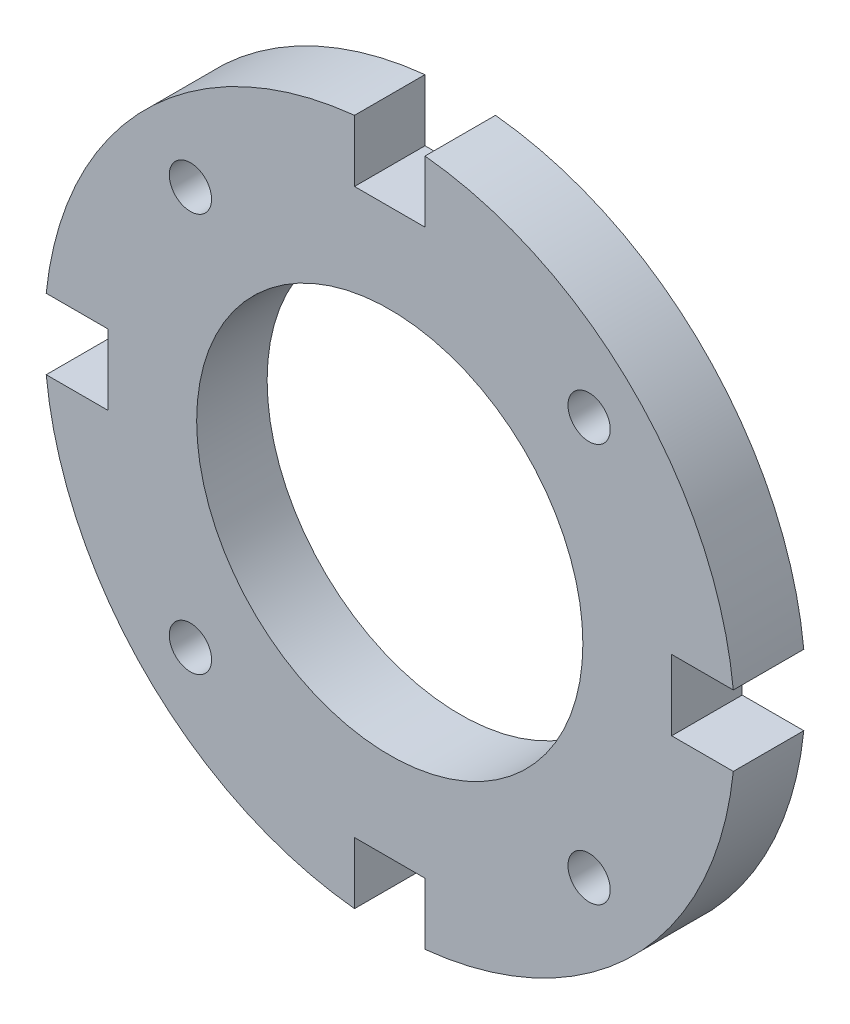
from build123d import *

# Parameters (mm, degrees)
ESQUISSE1_R        = 13.7
ESQUISSE1_R_2      = 1.5
BOSS_EXTRU_1_DEPTH = 5


with BuildPart() as part:
    # Esquisse1 → Boss.-Extru.1 (new body)
    with BuildSketch(Plane.XY):
        with BuildLine():
            Line((24.372115214, 2.5), (20, 2.5))
            Line((20, 2.5), (20, -2.5))
            Line((20, -2.5), (24.372115214, -2.5))
            ThreePointArc((24.372115214, -2.5), (17.324116139, -17.324116139), (2.5, -24.372115214))
            Line((2.5, -24.372115214), (2.5, -20))
            Line((2.5, -20), (-2.5, -20))
            Line((-2.5, -20), (-2.5, -24.372115214))
            ThreePointArc((-2.5, -24.372115214), (-17.324116139, -17.324116139), (-24.372115214, -2.5))
            Line((-24.372115214, -2.5), (-20, -2.5))
            Line((-20, -2.5), (-20, 2.5))
            Line((-20, 2.5), (-24.372115214, 2.5))
            ThreePointArc((-24.372115214, 2.5), (-17.324116139, 17.324116139), (-2.5, 24.372115214))
            Line((-2.5, 24.372115214), (-2.5, 20))
            Line((-2.5, 20), (2.5, 20))
            Line((2.5, 20), (2.5, 24.372115214))
            ThreePointArc((2.5, 24.372115214), (17.324116139, 17.324116139), (24.372115214, 2.5))
        make_face()
        Circle(ESQUISSE1_R, mode=Mode.SUBTRACT)
        with Locations((14.142135624, 14.142135624)):
            Circle(ESQUISSE1_R_2, mode=Mode.SUBTRACT)
        with Locations(Location((14.142135624, -14.142135624, 0), (0, 0, 180))):
            Circle(ESQUISSE1_R_2, mode=Mode.SUBTRACT)
        with Locations(Location((-14.142135624, 14.142135624, 0), (0, 0, 180))):
            Circle(ESQUISSE1_R_2, mode=Mode.SUBTRACT)
        with Locations((-14.142135624, -14.142135624)):
            Circle(ESQUISSE1_R_2, mode=Mode.SUBTRACT)
    extrude(amount=BOSS_EXTRU_1_DEPTH)


solid = part.part
